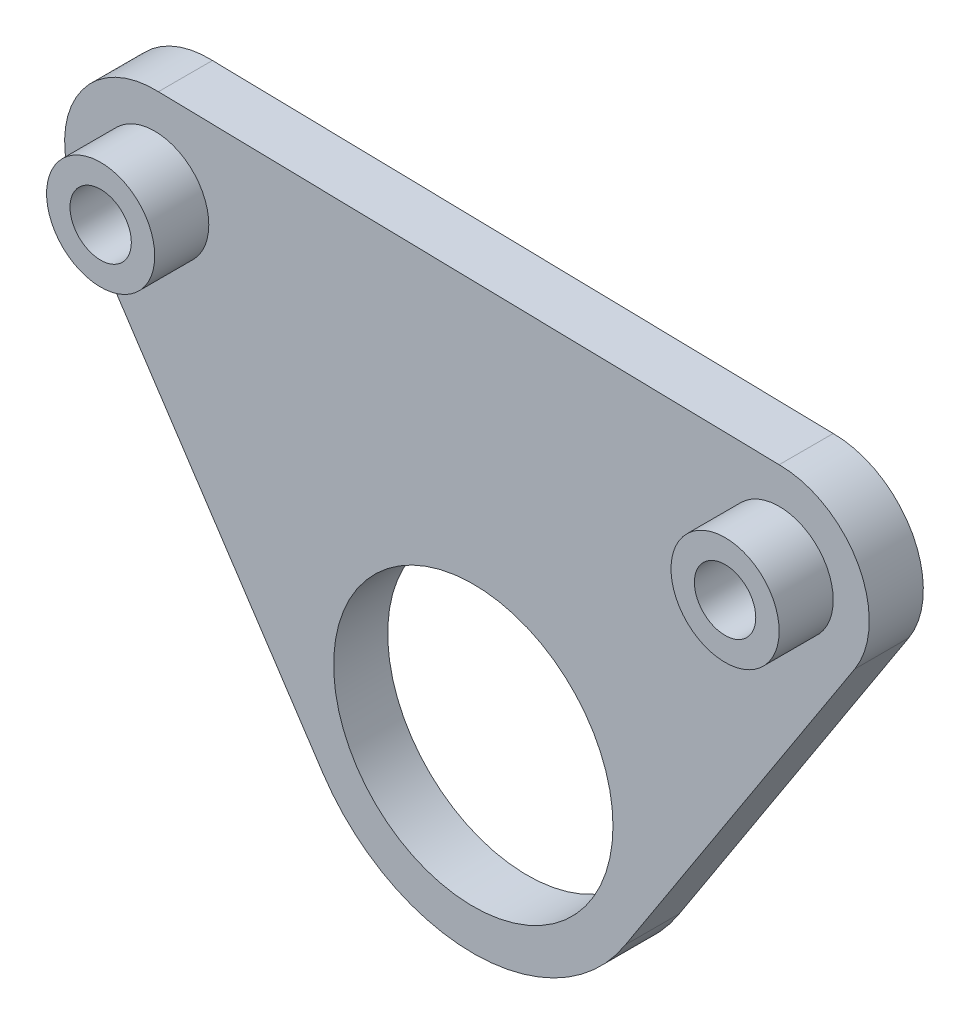
from build123d import *

# Parameters (mm, degrees)
SKETCH1_R                = 7.75
SKETCH1_R_2              = 3
BOSS_EXTRUDE3_DEPTH      = 3
BOSS_EXTRUDE4_DEPTH      = 3
BOSS_EXTRUDE4_DEPTH_BACK = 3
SKETCH3_R                = 3
SKETCH3_R_2              = 1.7025
CUT_EXTRUDE2_DEPTH       = 0.5


with BuildPart() as part:
    # Sketch1 → Boss-Extrude3 (new body)
    with BuildSketch(Plane.XY):
        with BuildLine():
            ThreePointArc((-17.47367286, 22.673506332), (-22.032126076, 20.135047844), (-21.848877926, 14.920674696))
            Line((-21.848877926, 14.920674696), (-8.342416793, -5.513989668))
            ThreePointArc((-8.342416793, -5.513989668), (0.084971894, -9.999638982), (8.434915556, -5.371424351))
            Line((8.434915556, -5.371424351), (21.165047264, 14.249110995))
            ThreePointArc((21.165047264, 14.249110995), (21.364152327, 19.357269814), (16.970562748, 21.970562748))
            Line((16.970562748, 21.970562748), (-17.47367286, 22.673506332))
        make_face()
        Circle(SKETCH1_R, mode=Mode.SUBTRACT)
        with Locations((-17.67766953, 17.67766953)):
            Circle(SKETCH1_R_2, mode=Mode.SUBTRACT)
        with Locations((16.970562748, 16.970562748)):
            Circle(SKETCH1_R_2, mode=Mode.SUBTRACT)
    extrude(amount=BOSS_EXTRUDE3_DEPTH)

    # Sketch3 → Boss-Extrude4 (add, two sides: drawn at the far end of the back side and taken through both)
    # profile 1 of 2: a face of its own
    with BuildSketch(Plane.XY.offset(3).offset(-BOSS_EXTRUDE4_DEPTH_BACK)):
        with Locations((-17.67766953, 17.67766953)):
            Circle(SKETCH3_R)
        with Locations((-17.67766953, 17.67766953)):
            Circle(SKETCH3_R_2, mode=Mode.SUBTRACT)
    # profile 2 of 2: a face of its own
    with BuildSketch(Plane.XY.offset(3).offset(-BOSS_EXTRUDE4_DEPTH_BACK)):
        with Locations((16.970562748, 16.970562748)):
            Circle(SKETCH3_R)
        with Locations((16.970562748, 16.970562748)):
            Circle(SKETCH3_R_2, mode=Mode.SUBTRACT)
    extrude(amount=BOSS_EXTRUDE4_DEPTH + BOSS_EXTRUDE4_DEPTH_BACK)

    # Sketch4 → Cut-Extrude2 (cut)
    with BuildSketch(Plane(origin=(0, 0, 0), x_dir=(-1, 0, 0), z_dir=(0, 0, -1))):
        with BuildLine():
            Line((-0.665908197, 13.903438218), (0.066062957, 13.903438218))
            add(Edge.make_bspline(
                [(0.066062957, 13.903438218), (0.114446028, 13.903266485), (0.207500301, 13.902936196), (0.341679481, 13.897725107), (0.46494151, 13.890473447), (0.577468889, 13.879407223), (0.679213477, 13.864734748), (0.770277246, 13.847438327), (0.850657534, 13.827725347), (0.921032238, 13.803161419), (0.984541929, 13.775453681), (1.04374179, 13.743616981), (1.099937859, 13.708005833), (1.152754525, 13.667683209), (1.202650778, 13.623374504), (1.24972075, 13.575035117), (1.293299299, 13.522255149), (1.333116584, 13.465368105), (1.369406835, 13.405524238), (1.401479805, 13.342641383), (1.427561597, 13.27667581), (1.450607657, 13.208580863), (1.467206987, 13.137383112), (1.478751578, 13.063775679), (1.487204076, 12.987499458), (1.487690054, 12.93568078), (1.487937957, 12.909247512)],
                knots=[0, 0, 0, 0, 1.749336639, 3.364467119, 4.854658419, 6.213483162, 7.451590619, 8.570285859, 9.5643256, 10.440900261, 11.26203566, 12.067320669, 12.869050712, 13.665104639, 14.467235401, 15.27997916, 16.102287765, 16.939272006, 17.78853747, 18.631303466, 19.488103222, 20.351255419, 21.228522269, 22.127379805, 23.044756219, 24, 24, 24, 24], degree=3))
            add(Edge.make_bspline(
                [(1.487937957, 12.909247512), (1.487293995, 12.881657254), (1.486031303, 12.827557785), (1.479229754, 12.748090078), (1.46679866, 12.672060935), (1.447969959, 12.599692959), (1.426328814, 12.530085447), (1.397551641, 12.4645227), (1.365073758, 12.402051204), (1.326500725, 12.343554641), (1.284168705, 12.287733687), (1.234937457, 12.236727048), (1.181996409, 12.187793312), (1.122369551, 12.143997521), (1.058685292, 12.102378362), (0.989678292, 12.064660321), (0.915798913, 12.029895252), (0.863858052, 12.010507848), (0.837296932, 12.000593666)],
                knots=[0, 0, 0, 0, 1.099860209, 2.156625411, 3.176576793, 4.16617041, 5.135385252, 6.078461593, 7.016046972, 7.938469504, 8.868247731, 9.803980173, 10.76021508, 11.73834243, 12.748633912, 13.790971185, 14.870363756, 16, 16, 16, 16], degree=3))
            Line((0.837296932, 12.000593666), (1.644989239, 10.403438218))
            Line((1.644989239, 10.403438218), (0.946671932, 10.403438218))
            Line((0.946671932, 10.403438218), (0.175437957, 11.929079243))
            Line((0.175437957, 11.929079243), (-0.037703068, 11.929079243))
            Line((-0.037703068, 11.929079243), (-0.037703068, 10.403438218))
            Line((-0.037703068, 10.403438218), (-0.665908197, 10.403438218))
            Line((-0.665908197, 10.403438218), (-0.665908197, 13.903438218))
        make_face()
        with BuildLine():
            Line((-0.037703068, 12.557284371), (0.206988438, 12.557284371))
            add(Edge.make_bspline(
                [(0.206988438, 12.557284371), (0.236904009, 12.557621301), (0.294185898, 12.558266448), (0.376564779, 12.561258908), (0.45138445, 12.568469257), (0.51896621, 12.577579265), (0.579650126, 12.588098083), (0.632894918, 12.60317219), (0.679521008, 12.619324476), (0.718975873, 12.639397578), (0.752685204, 12.662225049), (0.781791054, 12.688157623), (0.805865765, 12.718171276), (0.82568048, 12.751450365), (0.841094174, 12.788289236), (0.85234499, 12.828283482), (0.858632532, 12.871888689), (0.859355935, 12.90198222), (0.859732829, 12.917660974)],
                knots=[0, 0, 0, 0, 1.688639943, 3.233382647, 4.650958383, 5.928841754, 7.082724185, 8.122798841, 9.049171256, 9.863274652, 10.613301712, 11.341792392, 12.054588806, 12.776240173, 13.521029143, 14.301969904, 15.115324896, 16, 16, 16, 16], degree=3))
            add(Edge.make_bspline(
                [(0.859732829, 12.917660974), (0.859020277, 12.936210085), (0.857620601, 12.972646377), (0.843731463, 13.02510186), (0.821622957, 13.073652999), (0.791318249, 13.118080428), (0.75315341, 13.157028578), (0.709356247, 13.191361683), (0.658981509, 13.218509733), (0.612338294, 13.236416298), (0.56990387, 13.247129981), (0.531608141, 13.255113722), (0.487261456, 13.260772029), (0.436830336, 13.266773671), (0.380443332, 13.270665431), (0.317793101, 13.273505641), (0.249059573, 13.27466771), (0.201145777, 13.275039203), (0.176139079, 13.275233089)],
                knots=[0, 0, 0, 0, 1.020303359, 2.004196876, 2.966617323, 3.9489082, 4.950758222, 5.960522915, 7.003732012, 8.091992268, 8.70421221, 9.413913587, 10.24622431, 11.166358409, 12.212345909, 13.359657661, 14.621978493, 16, 16, 16, 16], degree=3))
            Line((0.176139079, 13.275233089), (-0.037703068, 13.275233089))
            Line((-0.037703068, 13.275233089), (-0.037703068, 12.557284371))
        make_face(mode=Mode.SUBTRACT)
    extrude(amount=-CUT_EXTRUDE2_DEPTH, mode=Mode.SUBTRACT)


solid = part.part
